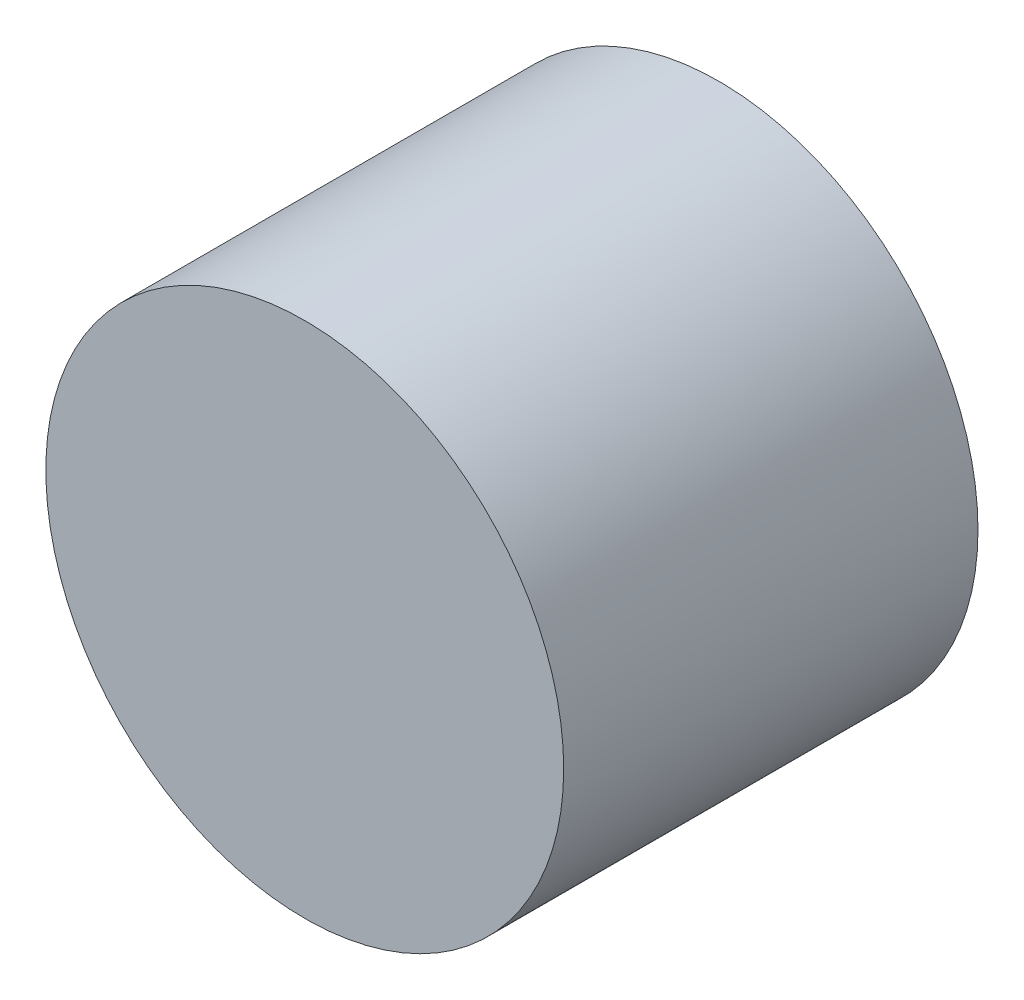
from build123d import *

# Parameters (mm, degrees)
SKETCH1_R    = 1.5
BALL_DEPTH   = 1
SKETCH2_R    = 2.5
SLEEVE_DEPTH = 4
BALL_ROUND_R = 0.9


with BuildPart() as part:
    # Sketch1 → Ball (new body)
    with BuildSketch(Plane.XY):
        Circle(SKETCH1_R)
    extrude(amount=BALL_DEPTH)

    # Sketch2 → Sleeve (add)
    with BuildSketch(Plane.XY.offset(1)):
        Circle(SKETCH2_R)
    extrude(amount=SLEEVE_DEPTH)

    # Ball_round
    ball_round_edges = [part.edges().sort_by_distance(p)[0] for p in [
        (-1.5, 0, 0),
    ]]
    fillet(ball_round_edges, radius=BALL_ROUND_R)


solid = part.part
